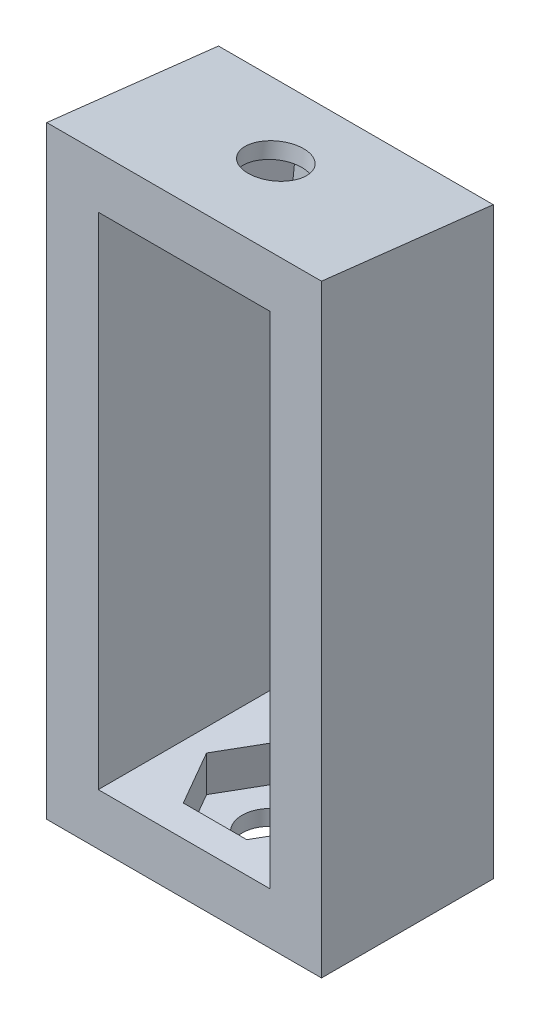
from build123d import *

# Parameters (mm, degrees)
SKETCH1_W           = 10
SKETCH1_H           = 34
BOSS_EXTRUDE1_DEPTH = 3
SKETCH2_W           = 10
SKETCH2_H           = 3
BOSS_EXTRUDE2_DEPTH = 3
SKETCH2_4_W         = 10
SKETCH2_4_H         = 3
BOSS_EXTRUDE3_DEPTH = 10
SKETCH6_R           = 1.625
CUT_EXTRUDE3_DEPTH  = 2.1
SKETCH6_3_R         = 1.625
CUT_EXTRUDE4_DEPTH  = 38.056556836
SKETCH5_R           = 1.625
CUT_EXTRUDE5_DEPTH  = 2.1
SKETCH5_4_R         = 1.625
CUT_EXTRUDE6_DEPTH  = 38.268461324


with BuildPart() as part:
    # Sketch1 → Boss-Extrude1 (new body)
    with BuildSketch(Plane(origin=(0, 0, 0), x_dir=(0, 0, -1), z_dir=(1, 0, 0))):
        with Locations((-5, 17)):
            Rectangle(SKETCH1_W, SKETCH1_H)
        Polygon((-10, 35.139356083), (0, 34), (-10, 34), align=None)
    extrude(amount=BOSS_EXTRUDE1_DEPTH)



with BuildPart() as body_2:
    # Sketch2 → Boss-Extrude2 (new body)
    with BuildSketch(Plane(origin=(13, 0, 0), x_dir=(0, 0, -1), z_dir=(1, 0, 0))):
        with Locations((-5, 1.5)):
            Rectangle(SKETCH2_W, SKETCH2_H)
        Polygon((-10, 3), (0, 3), (0, 30.980590802), (-10, 32.119946885), align=None)
        Polygon((-10, 32.119946885), (0, 30.980590802), (0, 34), (-10, 34), align=None)
        Polygon((-10, 34), (0, 34), (-10, 35.139356083), align=None)
    extrude(amount=BOSS_EXTRUDE2_DEPTH)


with BuildPart() as part_1:
    add(part.part)

    add(body_2.part)  # Boss-Extrude3 merges body 2
    # Sketch2<4> → Boss-Extrude3 (add)
    with BuildSketch(Plane(origin=(13, 0, 0), x_dir=(0, 0, -1), z_dir=(1, 0, 0))):
        with Locations((-5, 1.5)):
            Rectangle(SKETCH2_4_W, SKETCH2_4_H)
        Polygon((-10, 32.119946885), (0, 30.980590802), (0, 34), (-10, 34), align=None)
        Polygon((0, 34), (-10, 34), (-10, 35.139356083), align=None)
    extrude(amount=-BOSS_EXTRUDE3_DEPTH)

    # Sketch6 → Cut-Extrude3 (cut)
    # profile 1 of 2: a face of its own
    with BuildSketch(Plane(origin=(0, 30.583575534, -3.484558283), x_dir=(1, 0, 0), z_dir=(0, -0.9935718556765885, 0.11320321376789935))):
        Polygon((4.304958277, 8.539451107), (6.152479139, 5.339451107), (9.847520861, 5.339451107), (11.695041723, 8.539451107), (9.847520861, 11.739451107), (6.152479139, 11.739451107), align=None)
        with Locations((8, 8.539451107)):
            Circle(SKETCH6_R, mode=Mode.SUBTRACT)
    # profile 2 of 2: a face of its own
    with BuildSketch(Plane(origin=(0, 30.583575534, -3.484558283), x_dir=(1, 0, 0), z_dir=(0, -0.9935718556765885, 0.11320321376789935))):
        with Locations((8, 8.539451107)):
            Circle(SKETCH6_R)
    extrude(amount=-CUT_EXTRUDE3_DEPTH, mode=Mode.SUBTRACT)

    # Sketch6<3> → Cut-Extrude4 (cut, through all)
    with BuildSketch(Plane(origin=(0, 30.583575534, -3.484558283), x_dir=(1, 0, 0), z_dir=(0, -0.9935718556765885, 0.11320321376789935))):
        with Locations(Location((8, 8.539451107, 0), (0, 0, 270))):
            Circle(SKETCH6_3_R)
    extrude(amount=-CUT_EXTRUDE4_DEPTH, mode=Mode.SUBTRACT)

    # Sketch5 → Cut-Extrude5 (cut)
    with BuildSketch(Plane(origin=(0, 3, 0), x_dir=(1, 0, 0), z_dir=(0, 1, 0))):
        Polygon((6.152479139, -1.8), (4.304958277, -5), (6.152479139, -8.2), (9.847520861, -8.2), (11.695041723, -5), (9.847520861, -1.8), align=None)
        with Locations(Location((8, -5, 0), (0, 0, 270))):
            Circle(SKETCH5_R, mode=Mode.SUBTRACT)
    extrude(amount=-CUT_EXTRUDE5_DEPTH, mode=Mode.SUBTRACT)

    # Sketch5<4> → Cut-Extrude6 (cut, through all)
    with BuildSketch(Plane(origin=(0, 3, 0), x_dir=(1, 0, 0), z_dir=(0, 1, 0))):
        with Locations(Location((8, -5, 0), (0, 0, 270))):
            Circle(SKETCH5_4_R)
    extrude(amount=-CUT_EXTRUDE6_DEPTH, mode=Mode.SUBTRACT)


solid = part_1.part
